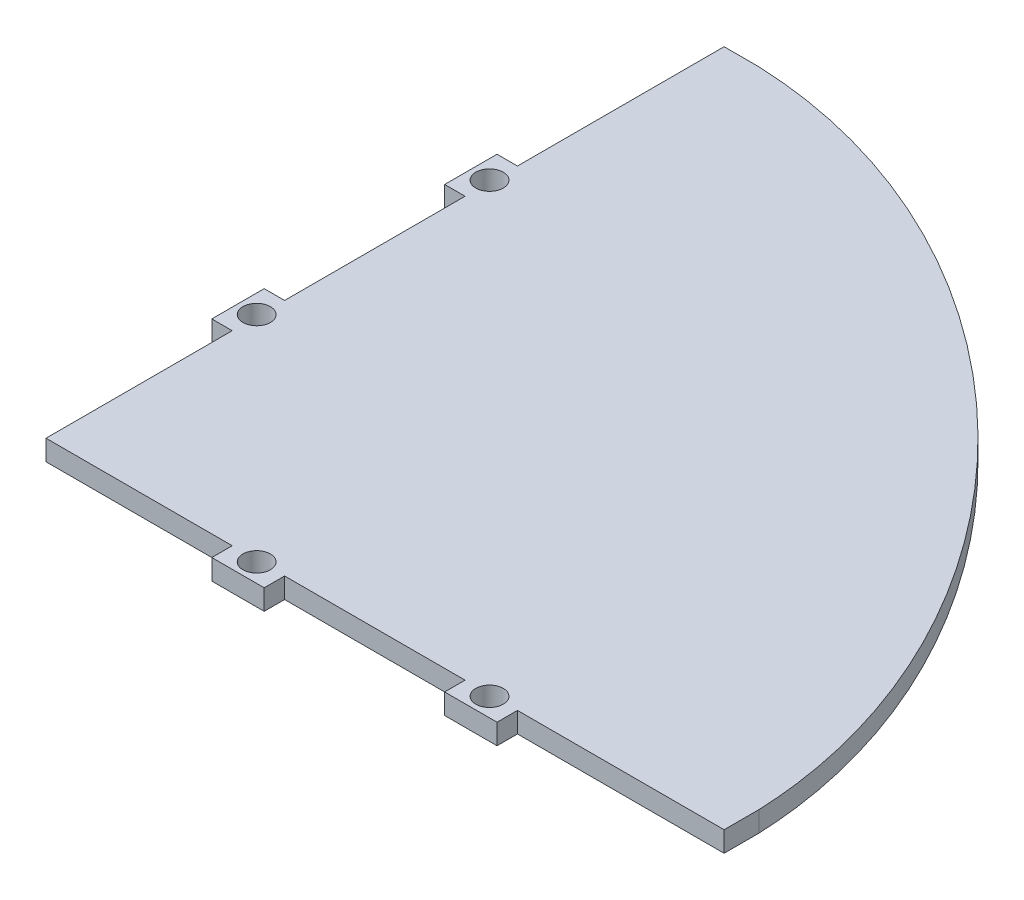
from build123d import *

# Parameters (mm, degrees)
EXTRUDE_1_DEPTH = 2.9718


with BuildPart() as part:
    # 草图1 → 凸台-拉伸1 (new body)
    with BuildSketch(Plane(origin=(0, 0, 0), x_dir=(1, 0, 0), z_dir=(0, 1, 0))):
        with BuildLine():
            Line((0, 60.951533333), (0, 34.704866667))
            Line((0, 34.704866667), (0, 32.878672101))
            ThreePointArc((0, 32.878672101), (1.247332741, 32.216229599), (1.746, 30.894866667))
            ThreePointArc((1.746, 30.894866667), (1.247332741, 29.573503734), (0, 28.911061233))
            Line((0, 28.911061233), (0, 27.084866667))
            Line((0, 27.084866667), (0, 0))
            Line((0, 0), (27.084866667, 0))
            Line((27.084866667, 0), (28.911061233, 0))
            ThreePointArc((28.911061233, 0), (30.894866667, 1.746), (32.878672101, 0))
            Line((32.878672101, 0), (34.704866667, 0))
            Line((34.704866667, 0), (60.951533333, 0))
            Line((60.951533333, 0), (62.777727899, 0))
            ThreePointArc((62.777727899, 0), (64.761533333, 1.746), (66.745338767, 0))
            Line((66.745338767, 0), (68.571533333, 0))
            Line((68.571533333, 0), (98.6282, 0))
            Line((98.6282, 0), (98.6282, 5.08))
            add(Edge.make_bspline(
                [(5.08, 98.6282), (49.328709516, 96.847818465), (96.847818465, 49.328709516), (98.6282, 5.08)],
                knots=[0.03565985, 0.03565985, 0.03565985, 0.03565985, 0.96434015, 0.96434015, 0.96434015, 0.96434015], degree=3))
            Line((5.08, 98.6282), (0, 98.6282))
            Line((0, 98.6282), (0, 68.571533333))
            Line((0, 68.571533333), (0, 66.745338767))
            ThreePointArc((0, 66.745338767), (1.247332741, 66.082896266), (1.746, 64.761533333))
            ThreePointArc((1.746, 64.761533333), (1.247332741, 63.440170401), (0, 62.777727899))
            Line((0, 62.777727899), (0, 60.951533333))
        make_face()
        with BuildLine():
            Line((-2.9718, 60.951533333), (0, 60.951533333))
            Line((0, 60.951533333), (0, 62.777727899))
            ThreePointArc((0, 62.777727899), (-2.254, 64.761533333), (0, 66.745338767))
            Line((0, 66.745338767), (0, 68.571533333))
            Line((0, 68.571533333), (-2.9718, 68.571533333))
            Line((-2.9718, 68.571533333), (-2.9718, 60.951533333))
        make_face()
        with BuildLine():
            Line((0, 32.878672101), (0, 34.704866667))
            Line((0, 34.704866667), (-2.9718, 34.704866667))
            Line((-2.9718, 34.704866667), (-2.9718, 27.084866667))
            Line((-2.9718, 27.084866667), (0, 27.084866667))
            Line((0, 27.084866667), (0, 28.911061233))
            ThreePointArc((0, 28.911061233), (-2.254, 30.894866667), (0, 32.878672101))
        make_face()
        with BuildLine():
            Line((28.911061233, 0), (27.084866667, 0))
            Line((27.084866667, 0), (27.084866667, -2.9718))
            Line((27.084866667, -2.9718), (34.704866667, -2.9718))
            Line((34.704866667, -2.9718), (34.704866667, 0))
            Line((34.704866667, 0), (32.878672101, 0))
            ThreePointArc((32.878672101, 0), (32.890813919, -0.126742128), (32.894866667, -0.254))
            ThreePointArc((32.894866667, -0.254), (30.767608795, -2.249947252), (28.911061233, 0))
        make_face()
        with BuildLine():
            Line((62.777727899, 0), (60.951533333, 0))
            Line((60.951533333, 0), (60.951533333, -2.9718))
            Line((60.951533333, -2.9718), (68.571533333, -2.9718))
            Line((68.571533333, -2.9718), (68.571533333, 0))
            Line((68.571533333, 0), (66.745338767, 0))
            ThreePointArc((66.745338767, 0), (66.757480586, -0.126742128), (66.761533333, -0.254))
            ThreePointArc((66.761533333, -0.254), (64.634275461, -2.249947252), (62.777727899, 0))
        make_face()
    extrude(amount=EXTRUDE_1_DEPTH)


solid = part.part
